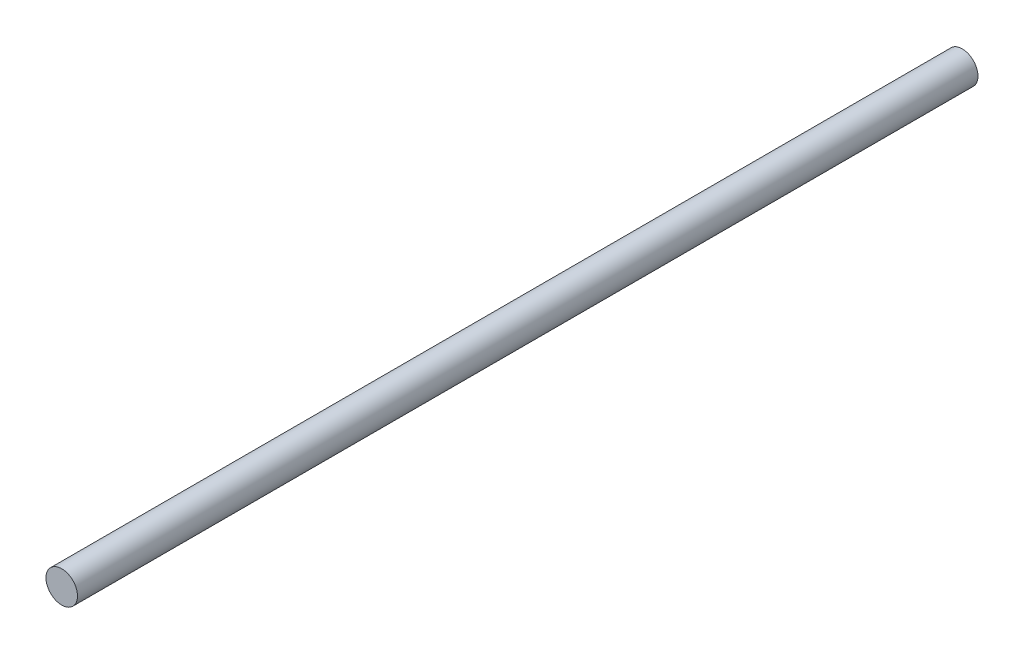
from build123d import *

# Parameters (mm, degrees)
SKETCH1_R           = 4
BOSS_EXTRUDE1_DEPTH = 228.5


with BuildPart() as part:
    # Sketch1 → Boss-Extrude1 (new body)
    with BuildSketch(Plane.XY):
        Circle(SKETCH1_R)
    extrude(amount=BOSS_EXTRUDE1_DEPTH)


solid = part.part
